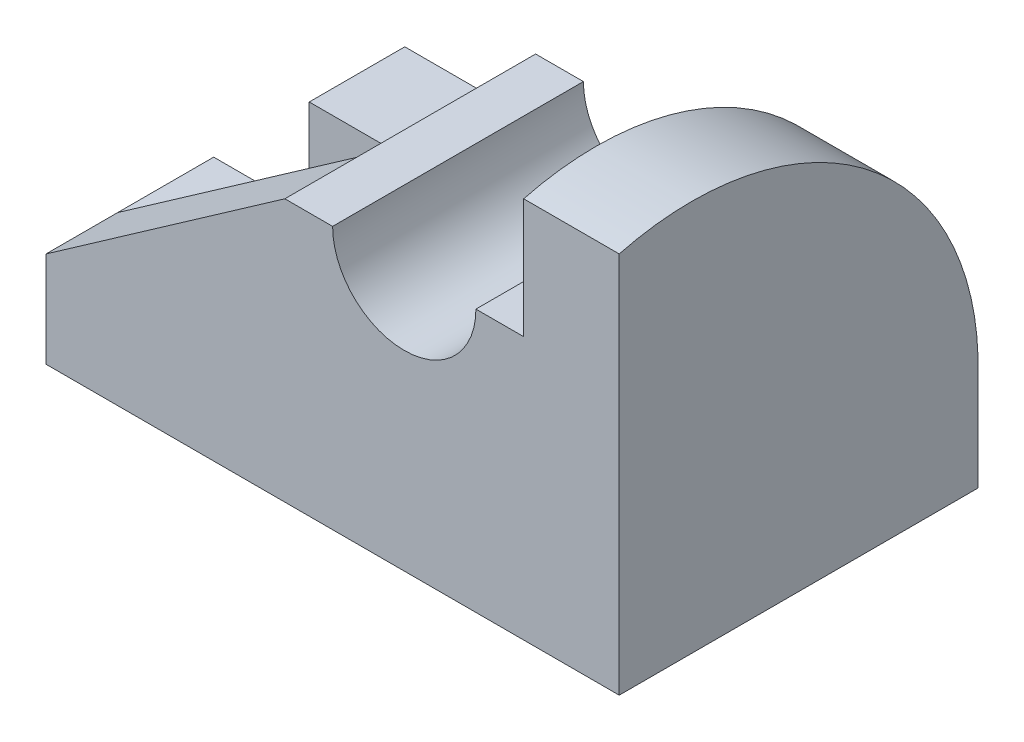
from build123d import *

# Parameters (mm, degrees)
SKETCH1_W           = 96
SKETCH1_H           = 60.085106382
BOSS_EXTRUDE2_DEPTH = 16
BOSS_EXTRUDE3_DEPTH = 16
SKETCH5_W           = 40
SKETCH5_H           = 42
BOSS_EXTRUDE4_DEPTH = 28
SKETCH6_R           = 12
CUT_EXTRUDE1_DEPTH  = 43
BOSS_EXTRUDE6_DEPTH = 12
CUT_EXTRUDE2_DEPTH  = 16


with BuildPart() as part:
    # Sketch1 → Boss-Extrude2 (new body)
    with BuildSketch(Plane(origin=(0, 0, 0), x_dir=(1, 0, 0), z_dir=(0, 1, 0))):
        Rectangle(SKETCH1_W, SKETCH1_H)
    extrude(amount=BOSS_EXTRUDE2_DEPTH)

    # Sketch4 → Boss-Extrude3 (add)
    with BuildSketch(Plane(origin=(48, 0, 0), x_dir=(0, 0, -1), z_dir=(1, 0, 0))):
        with BuildLine():
            Line((-30.042553191, 16), (-30.042553191, 64))
            ThreePointArc((-30.042553191, 64), (12.027119449, 55.055223992), (30.042553191, 16))
            Line((30.042553191, 16), (30.042553191, 0))
            Line((30.042553191, 0), (-30.042553191, 0))
            Line((-30.042553191, 0), (-30.042553191, 16))
        make_face()
    extrude(amount=-BOSS_EXTRUDE3_DEPTH)

    # Sketch5 → Boss-Extrude4 (add)
    with BuildSketch(Plane(origin=(0, 16, 0), x_dir=(1, 0, 0), z_dir=(0, 1, 0))):
        with Locations((12, -9.042553191)):
            Rectangle(SKETCH5_W, SKETCH5_H)
    extrude(amount=BOSS_EXTRUDE4_DEPTH)

    # Sketch6 → Cut-Extrude1 (cut)
    with BuildSketch(Plane.XY.offset(30.042553191)):
        with Locations((12, 44)):
            Circle(SKETCH6_R)
    extrude(amount=-CUT_EXTRUDE1_DEPTH, mode=Mode.SUBTRACT)

    # Sketch10 → Boss-Extrude6 (add)
    with BuildSketch(Plane.XY.offset(30.042553191)):
        Polygon((-8, 44), (-48, 16), (-8, 16), align=None)
    extrude(amount=-BOSS_EXTRUDE6_DEPTH)

    # Sketch11 → Cut-Extrude2 (cut)
    with BuildSketch(Plane(origin=(0, 16, 0), x_dir=(1, 0, 0), z_dir=(0, 1, 0))):
        with BuildLine():
            Line((-28, 14.042553191), (-48, 14.042553191))
            Line((-48, 14.042553191), (-48, -1.957446809))
            Line((-48, -1.957446809), (-28, -1.957446809))
            ThreePointArc((-28, -1.957446809), (-36, 6.042553191), (-28, 14.042553191))
        make_face()
        with BuildLine():
            ThreePointArc((-20, 6.042553191), (-22.343145751, 11.699407441), (-28, 14.042553191))
            Line((-28, 14.042553191), (-28, -1.957446809))
            ThreePointArc((-28, -1.957446809), (-22.343145751, 0.385698942), (-20, 6.042553191))
        make_face()
        with BuildLine():
            Line((-28, -1.957446809), (-28, 14.042553191))
            ThreePointArc((-28, 14.042553191), (-36, 6.042553191), (-28, -1.957446809))
        make_face()
    extrude(amount=-CUT_EXTRUDE2_DEPTH, mode=Mode.SUBTRACT)


solid = part.part
